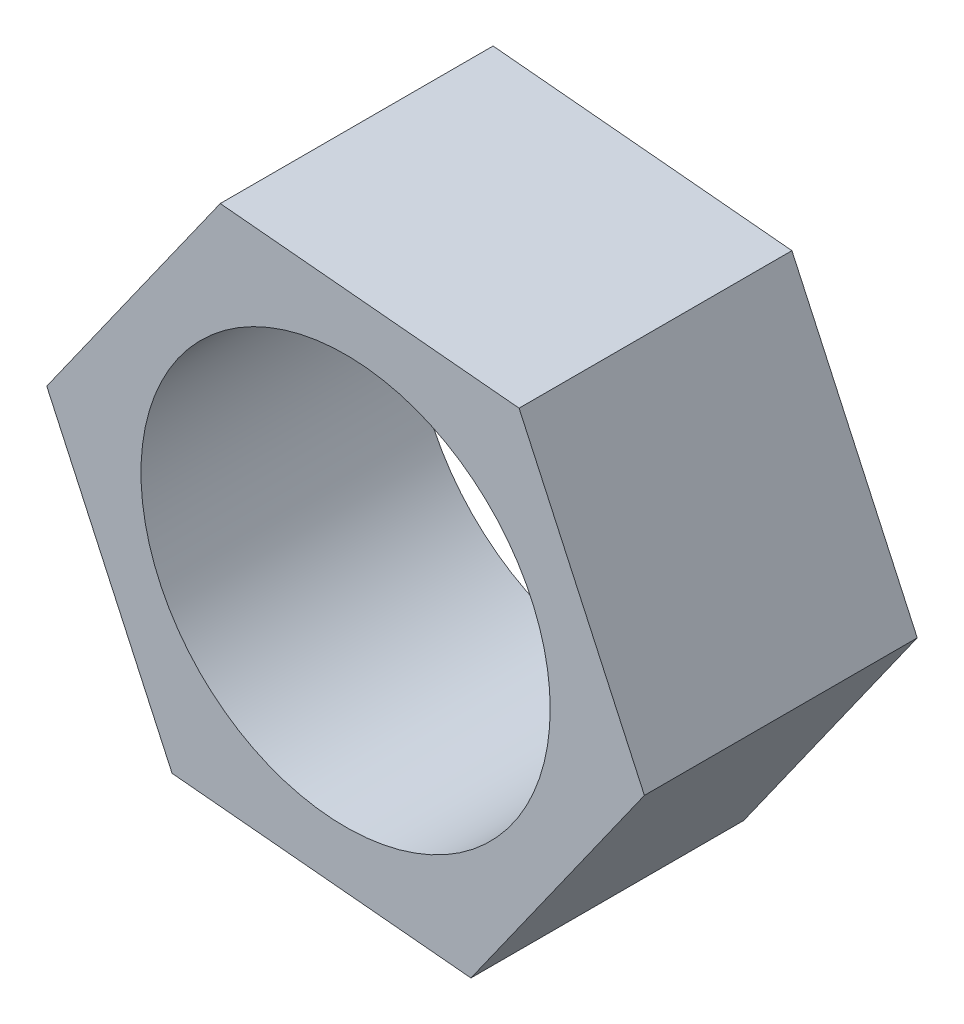
from build123d import *

# Parameters (mm, degrees)
ESBO_O1_R                = 7.5
RESSALTO_EXTRUS_O1_DEPTH = 10


with BuildPart() as part:
    # Esboço1 → Ressalto-extrusão1 (new body)
    with BuildSketch(Plane.XY):
        Polygon((6.359015559, 8.975684995), (-4.593663442, 9.994911514), (-10.952679001, 1.01922652), (-6.359015559, -8.975684995), (4.593663442, -9.994911514), (10.952679001, -1.01922652), align=None)
        Circle(ESBO_O1_R, mode=Mode.SUBTRACT)
    extrude(amount=RESSALTO_EXTRUS_O1_DEPTH)


solid = part.part
